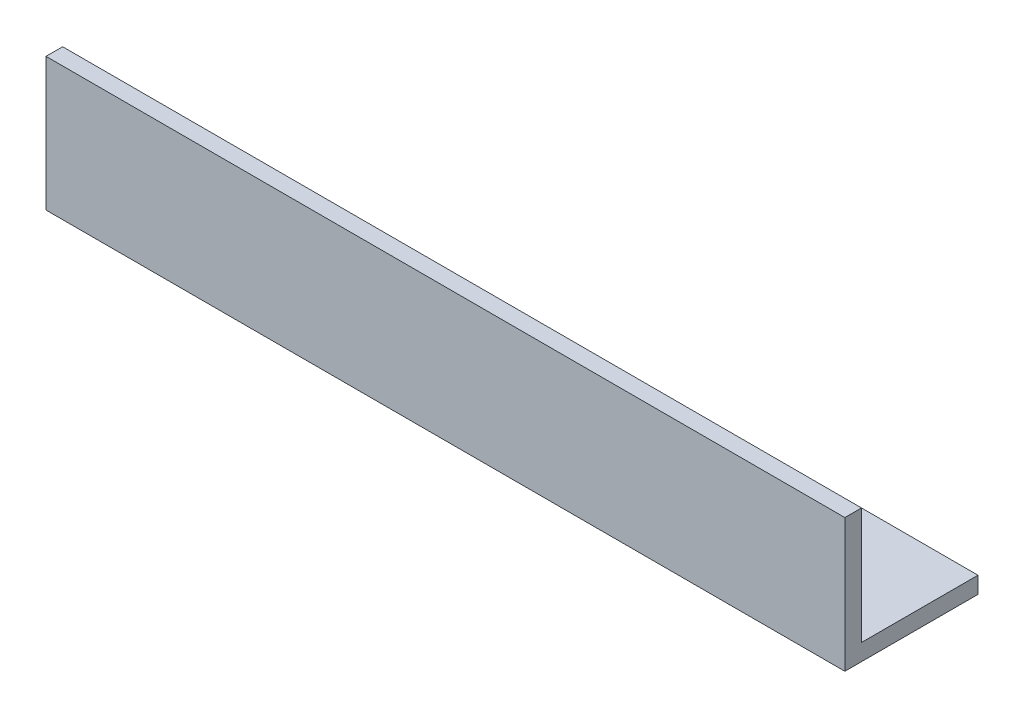
from build123d import *

# Parameters (mm, degrees)
BOSS_EXTRUDE1_DEPTH = 304.8
CUT_EXTRUDE1_DEPTH  = 313.185013253


with BuildPart() as part:
    # Sketch1 → Boss-Extrude1 (new body)
    with BuildSketch(Plane(origin=(0, 0, 0), x_dir=(0, 0, -1), z_dir=(1, 0, 0))):
        Polygon((0, 0), (50.8, 0), (50.8, 6.35), (6.35, 6.35), (6.35, 50.8), (0, 50.8), align=None)
    extrude(amount=BOSS_EXTRUDE1_DEPTH)

    # Sketch2 → Cut-Extrude1 (cut, through all)
    with BuildSketch(Plane(origin=(0, 6.35, 0), x_dir=(1, 0, 0), z_dir=(0, 1, 0))):
        with BuildLine():
            Line((53.975, 42.8625), (53.975, 17.4625))
            ThreePointArc((53.975, 17.4625), (50.8, 14.2875), (47.625, 17.4625))
            Line((47.625, 17.4625), (47.625, 42.8625))
            ThreePointArc((47.625, 42.8625), (50.8, 46.0375), (53.975, 42.8625))
        make_face()
        with BuildLine():
            Line((250.825, 42.8625), (250.825, 17.4625))
            ThreePointArc((250.825, 17.4625), (254, 14.2875), (257.175, 17.4625))
            Line((257.175, 17.4625), (257.175, 42.8625))
            ThreePointArc((257.175, 42.8625), (254, 46.0375), (250.825, 42.8625))
        make_face()
    extrude(amount=-CUT_EXTRUDE1_DEPTH, mode=Mode.SUBTRACT)


solid = part.part
